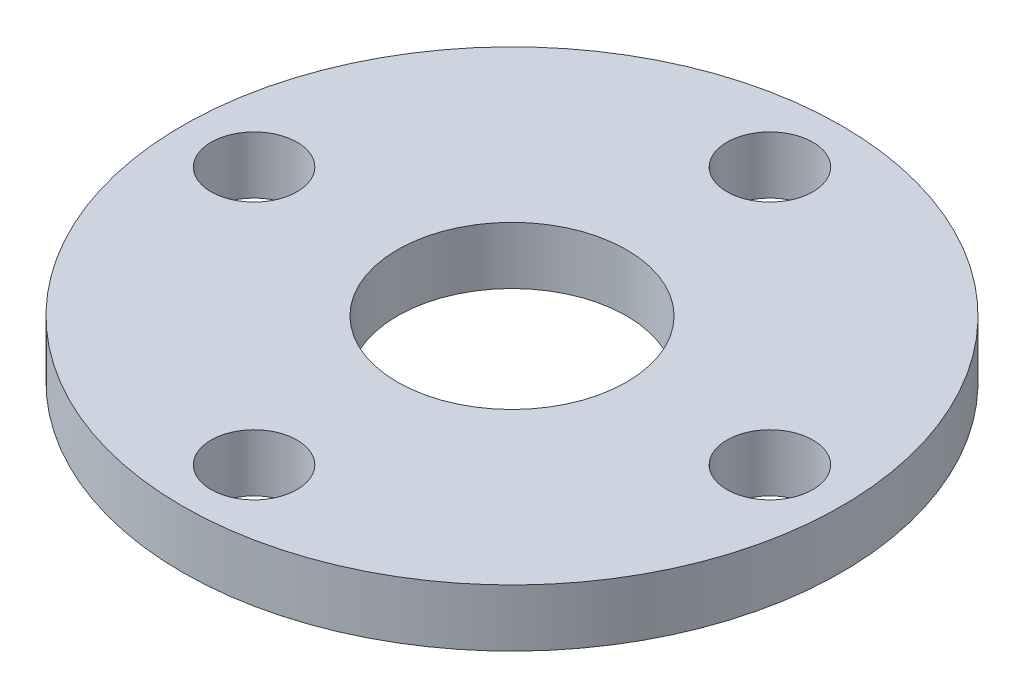
from build123d import *

# Parameters (mm, degrees)
SKETCH1_R           = 11.5
SKETCH1_R_2         = 4
SKETCH1_R_3         = 1.5
BOSS_EXTRUDE1_DEPTH = 2


with BuildPart() as part:
    # Sketch1 → Boss-Extrude1 (new body)
    with BuildSketch(Plane(origin=(0, 0, 0), x_dir=(1, 0, 0), z_dir=(0, 1, 0))):
        with Locations(Location((0, 0, 0), (0, 0, 270))):
            Circle(SKETCH1_R)
        with Locations(Location((0, 0, 0), (0, 0, 270))):
            Circle(SKETCH1_R_2, mode=Mode.SUBTRACT)
        with Locations(Location((9, 0, 0), (0, 0, 270))):
            Circle(SKETCH1_R_3, mode=Mode.SUBTRACT)
        with Locations(Location((0, 9, 0), (0, 0, 270))):
            Circle(SKETCH1_R_3, mode=Mode.SUBTRACT)
        with Locations(Location((-9, 0, 0), (0, 0, 270))):
            Circle(SKETCH1_R_3, mode=Mode.SUBTRACT)
        with Locations(Location((0, -9, 0), (0, 0, 270))):
            Circle(SKETCH1_R_3, mode=Mode.SUBTRACT)
    extrude(amount=BOSS_EXTRUDE1_DEPTH)


solid = part.part
